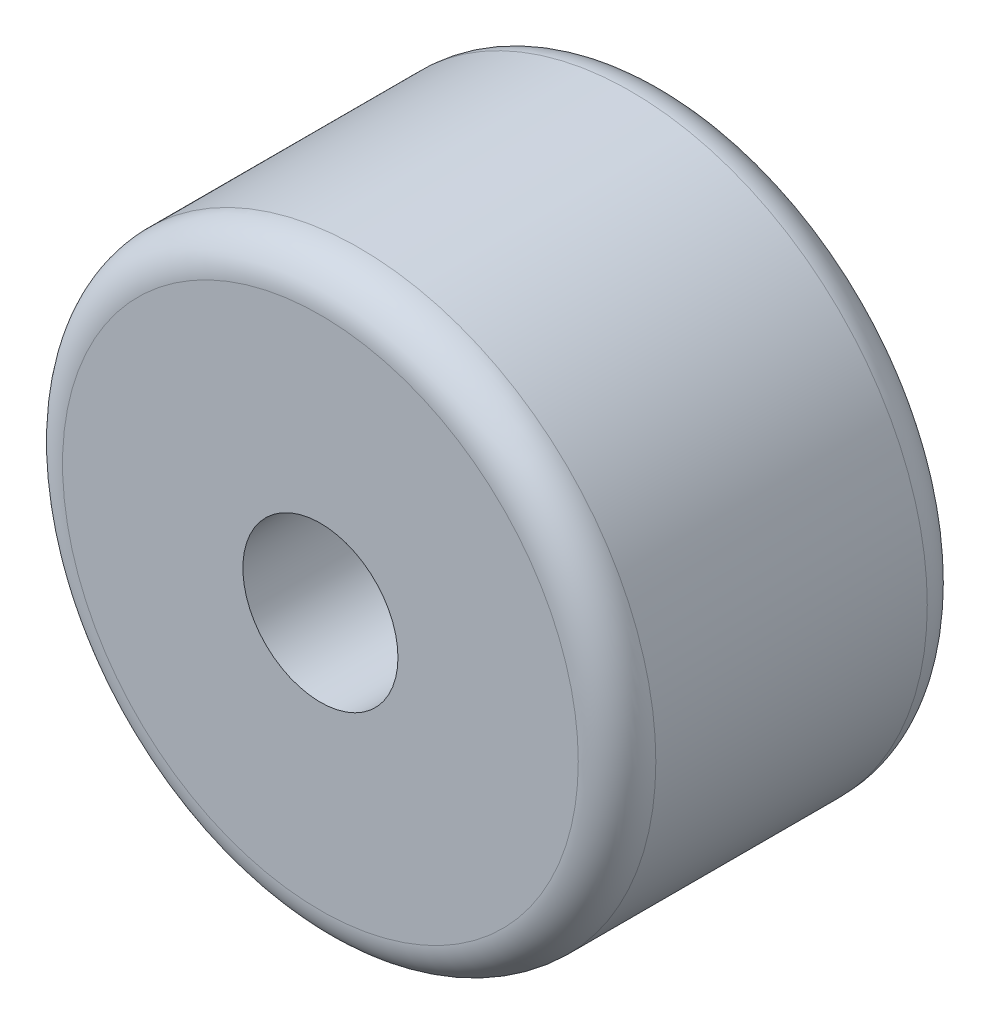
from build123d import *

# Parameters (mm, degrees)
SKETCH1_R           = 7.65
BOSS_EXTRUDE1_DEPTH = 9
SKETCH2_R           = 2
CUT_EXTRUDE2_DEPTH  = 9
FILLET1_R           = 1


with BuildPart() as part:
    # Sketch1 → Boss-Extrude1 (new body)
    with BuildSketch(Plane.XY):
        Circle(SKETCH1_R)
    extrude(amount=BOSS_EXTRUDE1_DEPTH)

    # Sketch2 → Cut-Extrude2 (cut)
    with BuildSketch(Plane.XY.offset(9)):
        Circle(SKETCH2_R)
    extrude(amount=-CUT_EXTRUDE2_DEPTH, mode=Mode.SUBTRACT)

    # Fillet1
    fillet1_edges = [part.edges().sort_by_distance(p)[0] for p in [
        (-7.65, 0, 0),
        (-7.65, 0, 9),
    ]]
    fillet(fillet1_edges, radius=FILLET1_R)


solid = part.part
